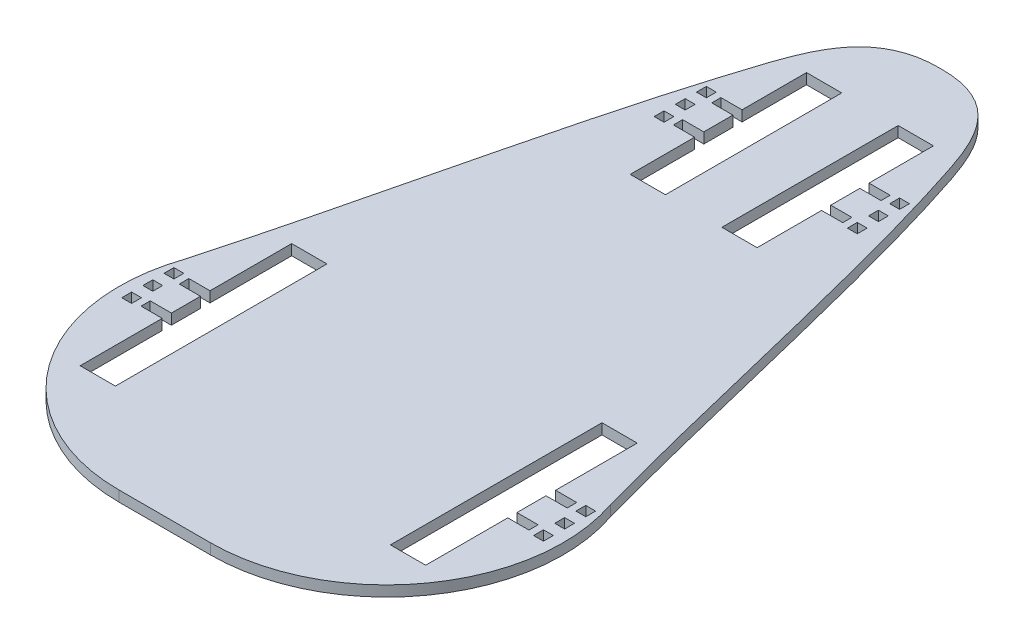
from build123d import *

# Parameters (mm, degrees)
SKETCH1_W           = 2.8
SKETCH1_H           = 2.8
BOSS_EXTRUDE1_DEPTH = 3


with BuildPart() as part:
    # Sketch1 → Boss-Extrude1 (new body)
    # profile 1 of 2: a face of its own
    with BuildSketch(Plane(origin=(0, 0, 0), x_dir=(1, 0, 0), z_dir=(0, 1, 0))):
        with BuildLine():
            add(Edge.make_bspline(
                [(54.921096065, 210.717166967), (55.81137077, 210.717166967), (73.117418641, 210.307735596), (83.168598293, 181.782075712), (97.327570014, 130.307145356), (107.26026966, 85.588568253), (115.245027256, 56.779324779)],
                knots=[0, 0, 0, 0, 0.011068307, 0.221366141, 0.459883166, 1, 1, 1, 1], degree=3))
            Line((54.921096065, 210.717166967), (54.921096065, -9.282833033))
            Line((54.921096065, -9.282833033), (64.921096065, -9.282833033))
            Line((64.921096065, -9.282833033), (67.895190019, -9.282833033))
            ThreePointArc((67.895190019, -9.282833033), (108.534505285, 11.589069626), (115.245027256, 56.779324779))
        make_face()
        with Locations((113.321095998, 39.717166967)):
            Rectangle(SKETCH1_W, SKETCH1_H, mode=Mode.SUBTRACT)
        Polygon((103.921096065, 38.99216559), (103.921096065, 15.717166967), (93.921096065, 15.717166967), (93.921096065, 75.717166967), (103.921096065, 75.717166967), (103.921096065, 52.548230604), (109.921096065, 52.548230604), (109.921096065, 49.842166967), (103.921096065, 49.842166967), (103.921096065, 41.59216559), (109.921095998, 41.59216559), (109.921095998, 38.99216559), align=None, mode=Mode.SUBTRACT)
        with Locations((113.321096065, 45.717166967)):
            Rectangle(SKETCH1_W, SKETCH1_H, mode=Mode.SUBTRACT)
        with Locations((113.321096065, 51.717166967)):
            Rectangle(SKETCH1_W, SKETCH1_H, mode=Mode.SUBTRACT)
        Polygon((72.921096065, 158.992166967), (72.921096065, 140.717166967), (62.921096065, 140.717166967), (62.921096065, 190.717166967), (72.921096065, 190.717166967), (72.921096065, 172.442166967), (78.921096065, 172.442166967), (78.921096065, 169.842166967), (72.921096065, 169.842166967), (72.921096065, 161.592166967), (78.921096065, 161.592166967), (78.921096065, 158.992166967), align=None, mode=Mode.SUBTRACT)
        with Locations((82.321096065, 159.717166967)):
            Rectangle(SKETCH1_W, SKETCH1_H, mode=Mode.SUBTRACT)
        with Locations((82.321096065, 165.717166967)):
            Rectangle(SKETCH1_W, SKETCH1_H, mode=Mode.SUBTRACT)
        with Locations((82.321096065, 171.717166967)):
            Rectangle(SKETCH1_W, SKETCH1_H, mode=Mode.SUBTRACT)
    # profile 2 of 2: a face of its own
    with BuildSketch(Plane(origin=(0, 0, 0), x_dir=(1, 0, 0), z_dir=(0, 1, 0))):
        with BuildLine():
            Line((54.921096065, -9.282833033), (54.921096065, 210.717166967))
            add(Edge.make_bspline(
                [(54.921096065, 210.717166967), (54.030821359, 210.717166967), (36.724773488, 210.307735596), (26.673593836, 181.782075712), (12.514622115, 130.307145356), (2.58192247, 85.588568253), (-5.402835127, 56.779324779)],
                knots=[0, 0, 0, 0, 0.011068307, 0.221366141, 0.459883166, 1, 1, 1, 1], degree=3))
            ThreePointArc((-5.402835127, 56.779324779), (1.307686844, 11.589069626), (41.94700211, -9.282833033))
            Line((41.94700211, -9.282833033), (44.921096065, -9.282833033))
            Line((44.921096065, -9.282833033), (54.921096065, -9.282833033))
        make_face()
        with Locations((-3.478903869, 39.717166967)):
            Rectangle(SKETCH1_W, SKETCH1_H, mode=Mode.SUBTRACT)
        with Locations((-3.478903935, 45.717166967)):
            Rectangle(SKETCH1_W, SKETCH1_H, mode=Mode.SUBTRACT)
        with Locations((-3.478903935, 51.717166967)):
            Rectangle(SKETCH1_W, SKETCH1_H, mode=Mode.SUBTRACT)
        Polygon((5.921096065, 52.548230604), (5.921096065, 75.717166967), (15.921096065, 75.717166967), (15.921096065, 15.717166967), (5.921096065, 15.717166967), (5.921096065, 38.99216559), (-0.078903869, 38.99216559), (-0.078903869, 41.59216559), (5.921096131, 41.59216559), (5.921096065, 49.842166967), (-0.078903935, 49.842166967), (-0.078903935, 52.548230604), align=None, mode=Mode.SUBTRACT)
        with Locations((27.521096065, 159.717166967)):
            Rectangle(SKETCH1_W, SKETCH1_H, mode=Mode.SUBTRACT)
        with Locations((27.521096065, 165.717166967)):
            Rectangle(SKETCH1_W, SKETCH1_H, mode=Mode.SUBTRACT)
        Polygon((36.921096065, 172.442166967), (36.921096065, 190.717166967), (46.921096065, 190.717166967), (46.921096065, 140.717166967), (36.921096065, 140.717166967), (36.921096065, 158.992166967), (30.921096065, 158.992166967), (30.921096065, 161.592166967), (36.921096065, 161.592166967), (36.921096065, 169.842166967), (30.921096065, 169.842166967), (30.921096065, 172.442166967), align=None, mode=Mode.SUBTRACT)
        with Locations((27.521096065, 171.717166967)):
            Rectangle(SKETCH1_W, SKETCH1_H, mode=Mode.SUBTRACT)
    extrude(amount=BOSS_EXTRUDE1_DEPTH)


solid = part.part
